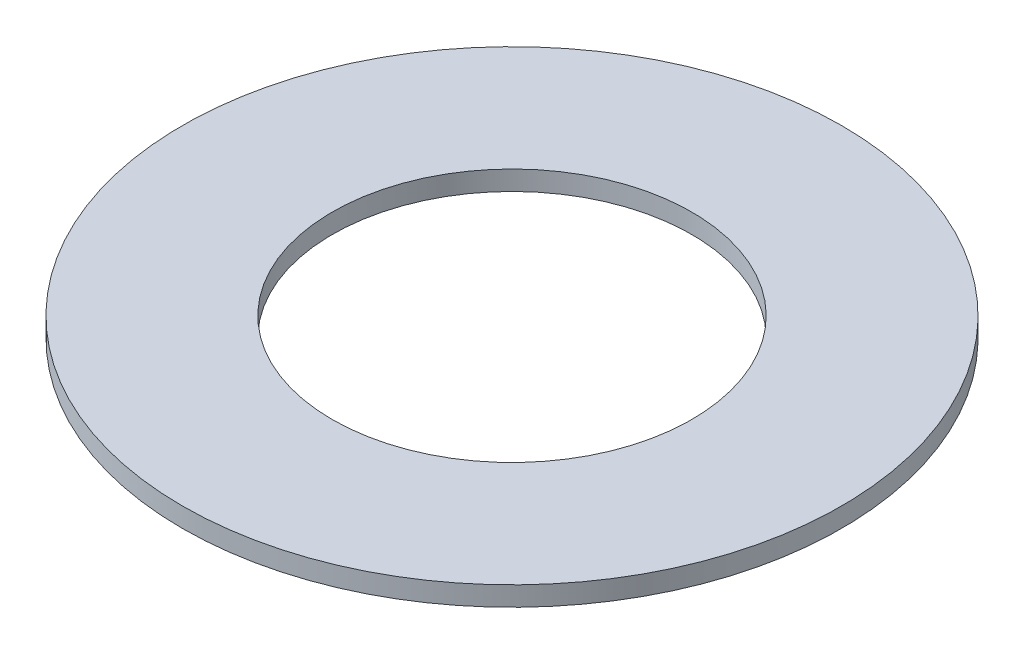
from build123d import *

# Parameters (mm, degrees)
CROQUIS1_R              = 11
CROQUIS1_R_2            = 6
SALIENTE_EXTRUIR1_DEPTH = 0.65


with BuildPart() as part:
    # Croquis1 → Saliente-Extruir1 (new body)
    with BuildSketch(Plane(origin=(0, 0, 0), x_dir=(1, 0, 0), z_dir=(0, 1, 0))):
        with Locations(Location((0, 0, 0), (0, 0, 270))):
            Circle(CROQUIS1_R)
        with Locations(Location((0, 0, 0), (0, 0, 270))):
            Circle(CROQUIS1_R_2, mode=Mode.SUBTRACT)
    extrude(amount=SALIENTE_EXTRUIR1_DEPTH)


solid = part.part
